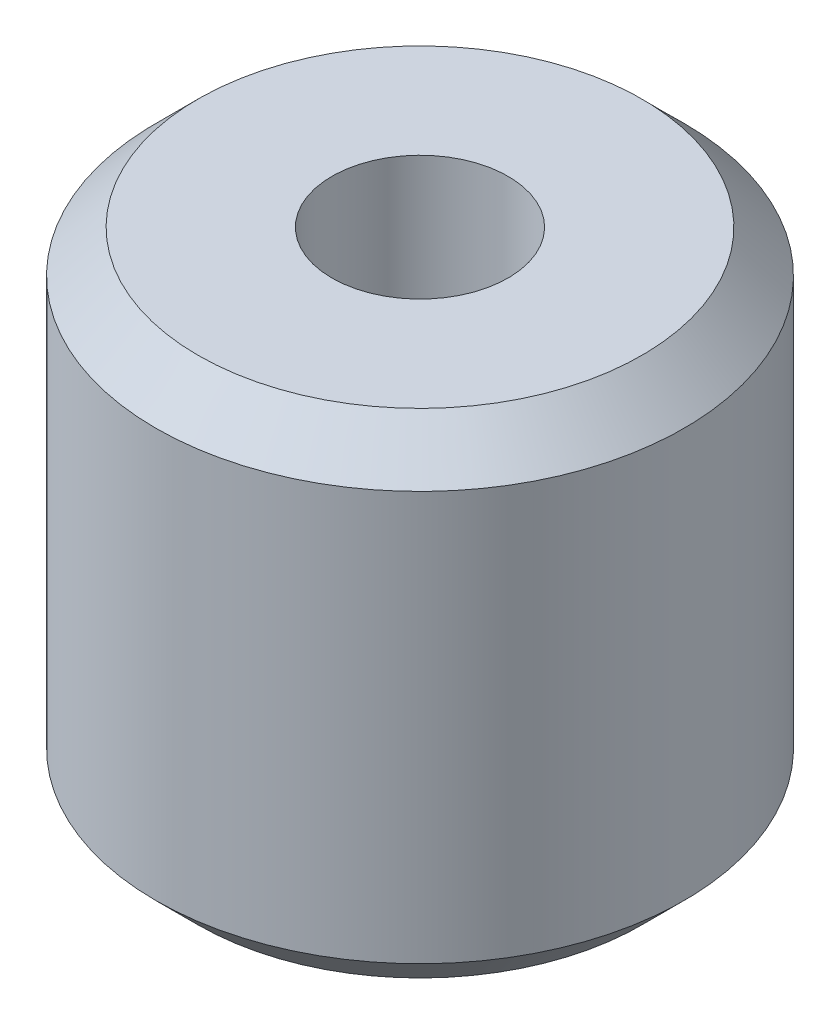
from build123d import *

# Parameters (mm, degrees)
SKETCH1_R           = 4.765
SKETCH1_R_2         = 1.59
BOSS_EXTRUDE1_DEPTH = 4.45
CHAMFER1_SIZE       = 0.76


with BuildPart() as part:
    # Sketch1 → Boss-Extrude1 (new, symmetric)
    with BuildSketch(Plane(origin=(0, 0, 0), x_dir=(1, 0, 0), z_dir=(0, 1, 0))):
        with Locations(Location((0, 0, 0), (0, 0, 270))):
            Circle(SKETCH1_R)
        with Locations(Location((0, 0, 0), (0, 0, 270))):
            Circle(SKETCH1_R_2, mode=Mode.SUBTRACT)
    extrude(amount=BOSS_EXTRUDE1_DEPTH, both=True)

    # Chamfer1
    chamfer1_edges = [part.edges().sort_by_distance(p)[0] for p in [
        (0, -4.45, -4.765),
        (0, 4.45, -4.765),
    ]]
    chamfer(chamfer1_edges, length=CHAMFER1_SIZE)


solid = part.part
